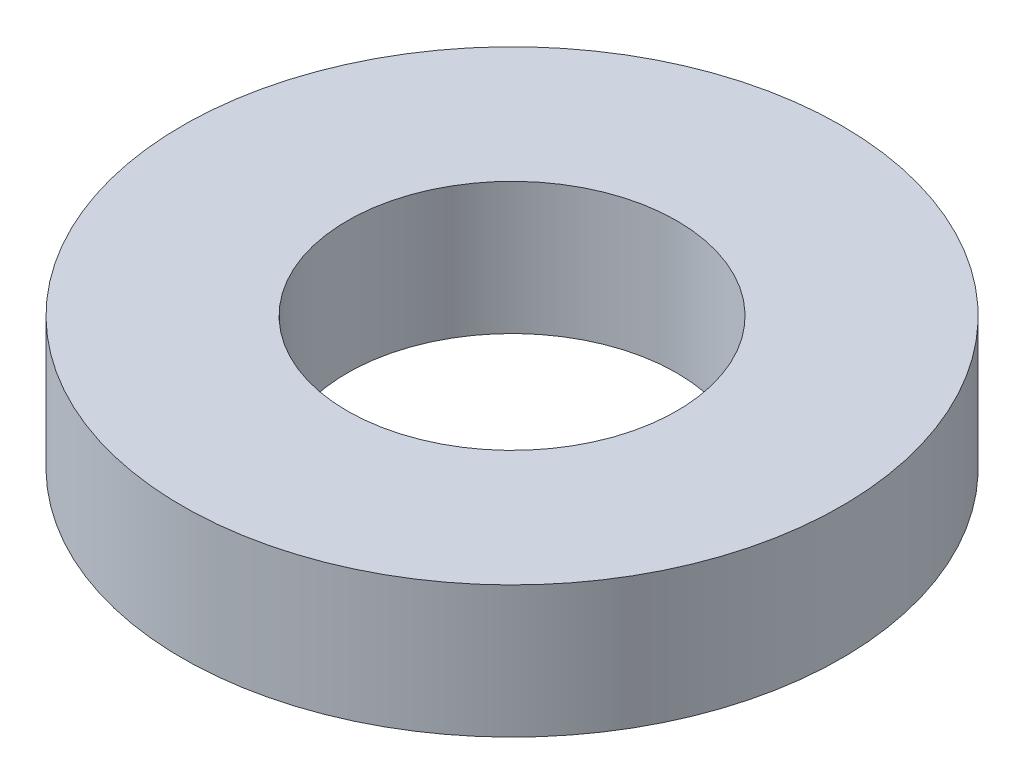
from build123d import *

# Parameters (mm, degrees)
SKETCH1_W = 2.5
SKETCH1_H = 2


with BuildPart() as part:
    # Sketch1 → Revolve1 (revolve)
    with BuildSketch(Plane.XY):
        with Locations((3.75, 0)):
            Rectangle(SKETCH1_W, SKETCH1_H)
    revolve(axis=Axis((0, 0, 0), (0, 1, 0)))


solid = part.part
